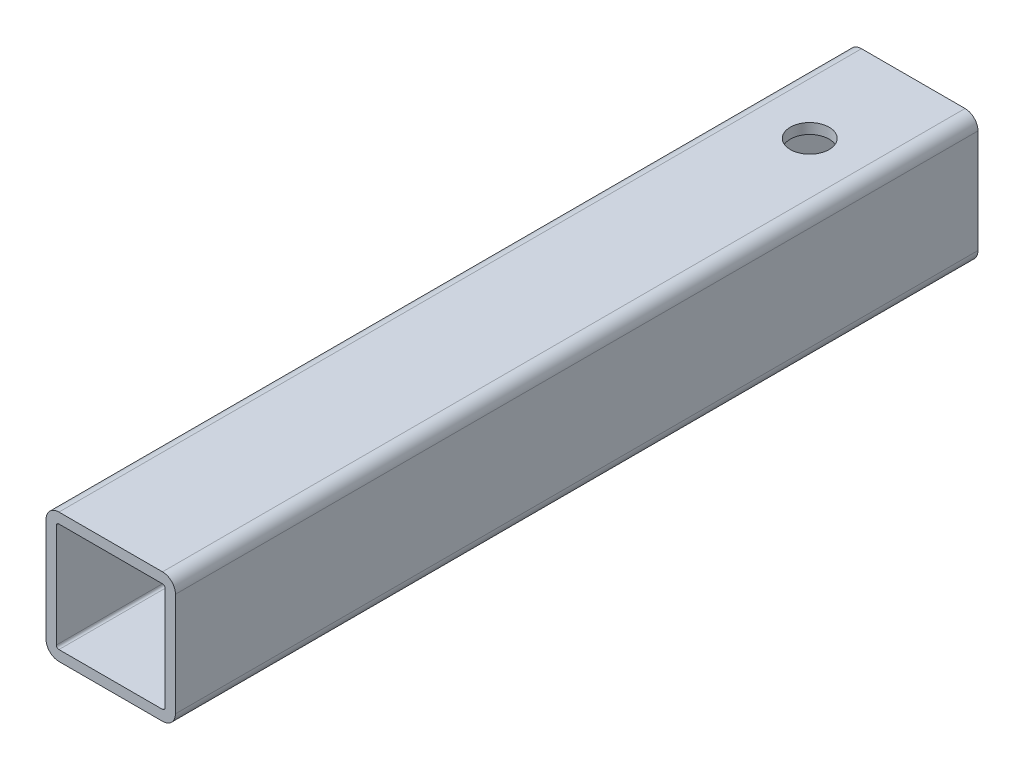
from build123d import *

# Parameters (mm, degrees)
TUBE_SQUARE_TS3X3X0_3125_3_DEPTH = 310
SKETCH12_R                       = 7.5
CUT_EXTRUDE1_DEPTH               = 165.772570533


with BuildPart() as part:
    # Sketch11 → Tube square TS3X3X0.3125(3) (new body)
    with BuildSketch(Plane(origin=(0, 0, -155), x_dir=(0, -1, 0), z_dir=(0, 0, 1))):
        with BuildLine():
            Line((-20, -25), (20, -25))
            ThreePointArc((20, -25), (23.535533906, -23.535533906), (25, -20))
            Line((25, -20), (25, 20))
            ThreePointArc((25, 20), (23.535533906, 23.535533906), (20, 25))
            Line((20, 25), (-20, 25))
            ThreePointArc((-20, 25), (-23.535533906, 23.535533906), (-25, 20))
            Line((-25, 20), (-25, -20))
            ThreePointArc((-25, -20), (-23.535533906, -23.535533906), (-20, -25))
        make_face()
        with BuildLine():
            Line((-20, -21), (20, -21))
            ThreePointArc((20, -21), (20.707106781, -20.707106781), (21, -20))
            Line((21, -20), (21, 20))
            ThreePointArc((21, 20), (20.707106781, 20.707106781), (20, 21))
            Line((20, 21), (-20, 21))
            ThreePointArc((-20, 21), (-20.707106781, 20.707106781), (-21, 20))
            Line((-21, 20), (-21, -20))
            ThreePointArc((-21, -20), (-20.707106781, -20.707106781), (-20, -21))
        make_face(mode=Mode.SUBTRACT)
    extrude(amount=TUBE_SQUARE_TS3X3X0_3125_3_DEPTH)

    # Sketch12 → Cut-Extrude1 (cut, through all)
    with BuildSketch(Plane(origin=(0, 25, 0), x_dir=(1, 0, 0), z_dir=(0, 1, 0))):
        with Locations(Location((0, 115, 0), (0, 0, 180))):
            Circle(SKETCH12_R)
    extrude(amount=-CUT_EXTRUDE1_DEPTH, mode=Mode.SUBTRACT)


solid = part.part
